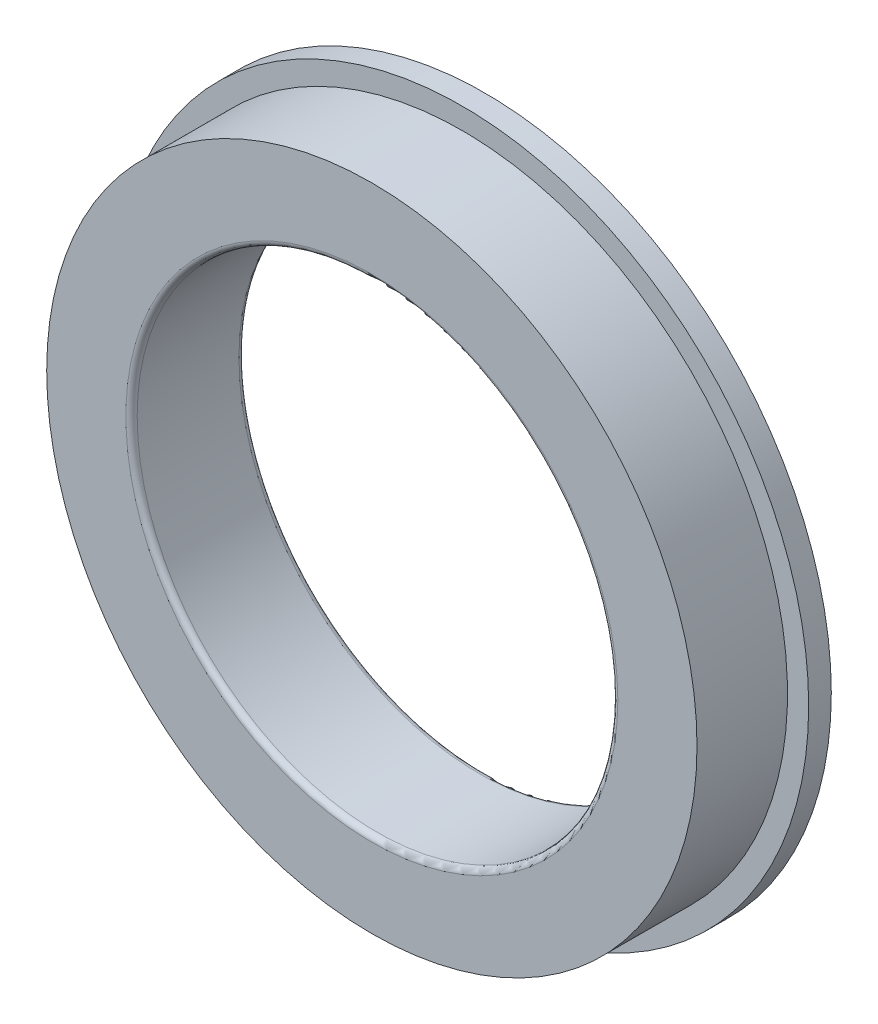
from build123d import *

# Parameters (mm, degrees)
SKETCH_1_R      = 11.5
SKETCH_1_R_2    = 8.5
EXTRUDE_1_DEPTH = 4
SKETCH_2_R      = 12.25
SKETCH_2_R_2    = 11.5
EXTRUDE_2_DEPTH = 0.8
FILLET_1_R      = 0.2


with BuildPart() as part:
    # ｽｹｯﾁ1 → 押し出し-薄板1 (new body)
    with BuildSketch(Plane.XY):
        Circle(SKETCH_1_R)
        Circle(SKETCH_1_R_2, mode=Mode.SUBTRACT)
    extrude(amount=EXTRUDE_1_DEPTH)

    # ｽｹｯﾁ2 → 押し出し-薄板2 (add)
    with BuildSketch(Plane(origin=(0, 0, 0), x_dir=(-1, 0, 0), z_dir=(0, 0, -1))):
        Circle(SKETCH_2_R)
        Circle(SKETCH_2_R_2, mode=Mode.SUBTRACT)
    extrude(amount=-EXTRUDE_2_DEPTH)

    # ﾌｨﾚｯﾄ1
    fillet_1_edges = [part.edges().sort_by_distance(p)[0] for p in [
        (-8.5, 0, 0),
        (-8.5, 0, 4),
    ]]
    fillet(fillet_1_edges, radius=FILLET_1_R)


solid = part.part
